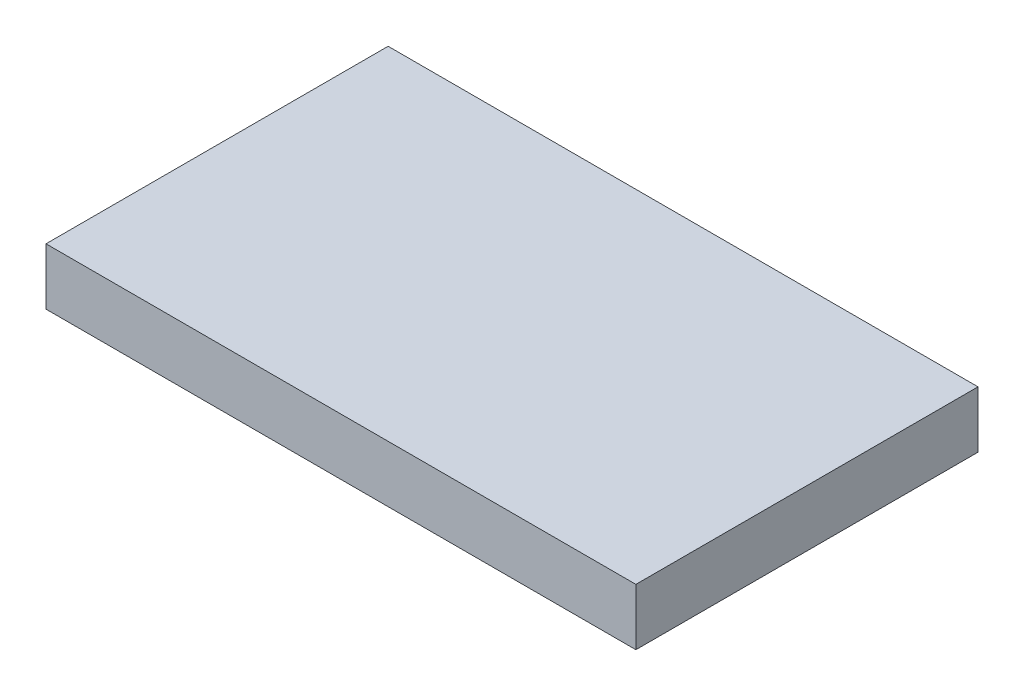
from build123d import *

# Parameters (mm, degrees)
SKETCH_1_W      = 50
SKETCH_1_H      = 29
EXTRUDE_1_DEPTH = 4.8


with BuildPart() as part:
    # Эскиз1 → Бобышка-Вытянуть1 (new body)
    with BuildSketch(Plane(origin=(0, 0, 0), x_dir=(1, 0, 0), z_dir=(0, 1, 0))):
        Rectangle(SKETCH_1_W, SKETCH_1_H)
    extrude(amount=EXTRUDE_1_DEPTH)


solid = part.part
